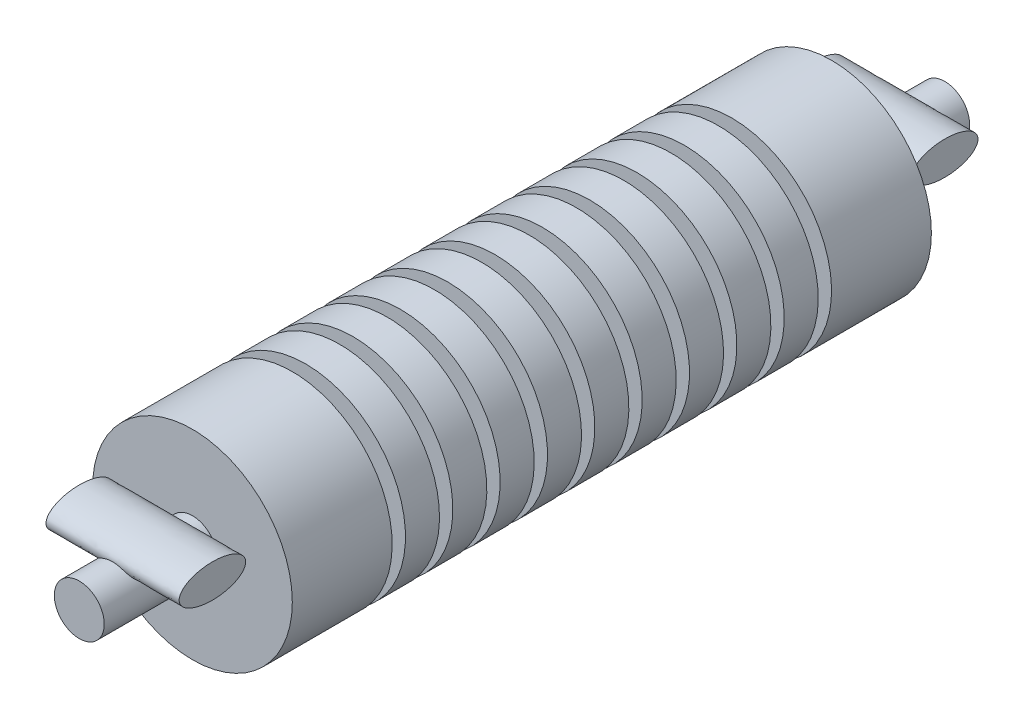
from build123d import *

# Parameters (mm, degrees)
SKETCH1_R               = 1.5
BOSS_EXTRUDE1_DEPTH     = 4.8
CUT_EXTRUDE1_DEPTH      = 6.247856705
CUT_EXTRUDE1_DEPTH_BACK = 6.247856705
SKETCH2_W               = 0.2
SKETCH2_H               = 3
SKETCH3_R               = 0.375
BOSS_EXTRUDE2_DEPTH     = 6.5
SKETCH4_RX              = 0.5
SKETCH4_RY              = 0.25
BOSS_EXTRUDE3_DEPTH     = 1


with BuildPart() as part:
    # Sketch1 → Boss-Extrude1 (new, symmetric)
    with BuildSketch(Plane.XY):
        Circle(SKETCH1_R)
    extrude(amount=BOSS_EXTRUDE1_DEPTH, both=True)

    # Sketch2 → Cut-Extrude1 (cut, two sides: drawn at the far end of the back side and taken through both)
    with BuildSketch(Plane(origin=(0, 0, 0), x_dir=(0, 0, -1), z_dir=(1, 0, 0)).offset(-CUT_EXTRUDE1_DEPTH_BACK)):
        with Locations((-3.2, 0)):
            Rectangle(SKETCH2_W, SKETCH2_H)
        with Locations((-2.488888889, 0)):
            Rectangle(SKETCH2_W, SKETCH2_H)
        with Locations((-1.777777778, 0)):
            Rectangle(SKETCH2_W, SKETCH2_H)
        with Locations((-1.066666667, 0)):
            Rectangle(SKETCH2_W, SKETCH2_H)
        with Locations((-0.355555556, 0)):
            Rectangle(SKETCH2_W, SKETCH2_H)
        with Locations((0.355555556, 0)):
            Rectangle(SKETCH2_W, SKETCH2_H)
        with Locations((1.066666667, 0)):
            Rectangle(SKETCH2_W, SKETCH2_H)
        with Locations((1.777777778, 0)):
            Rectangle(SKETCH2_W, SKETCH2_H)
        with Locations((2.488888889, 0)):
            Rectangle(SKETCH2_W, SKETCH2_H)
        with Locations((3.2, 0)):
            Rectangle(SKETCH2_W, SKETCH2_H)
    extrude(amount=CUT_EXTRUDE1_DEPTH + CUT_EXTRUDE1_DEPTH_BACK, mode=Mode.SUBTRACT)


with BuildPart() as cut_extrude1_piece_1:
    # of the separate pieces the step leaves, piece 1, a body of its own (cut_extrude1_pieces)
    add(part.part.solids().sort_by_distance((1.5, 0, -4.8))[0])



with BuildPart() as cut_extrude1_piece_2:
    # of the separate pieces the step leaves, piece 2, a body of its own (cut_extrude1_pieces)
    add(part.part.solids().sort_by_distance((1.5, 0, 3.3))[0])


with BuildPart() as cut_extrude1_piece_3:
    # of the separate pieces the step leaves, piece 3, a body of its own (cut_extrude1_pieces)
    add(part.part.solids().sort_by_distance((1.5, 0, 2.588888889))[0])


with BuildPart() as cut_extrude1_piece_4:
    # of the separate pieces the step leaves, piece 4, a body of its own (cut_extrude1_pieces)
    add(part.part.solids().sort_by_distance((1.5, 0, -1.677777778))[0])


with BuildPart() as cut_extrude1_piece_5:
    # of the separate pieces the step leaves, piece 5, a body of its own (cut_extrude1_pieces)
    add(part.part.solids().sort_by_distance((1.5, 0, -3.1))[0])


with BuildPart() as cut_extrude1_piece_6:
    # of the separate pieces the step leaves, piece 6, a body of its own (cut_extrude1_pieces)
    add(part.part.solids().sort_by_distance((1.5, 0, -2.388888889))[0])


with BuildPart() as cut_extrude1_piece_7:
    # of the separate pieces the step leaves, piece 7, a body of its own (cut_extrude1_pieces)
    add(part.part.solids().sort_by_distance((1.5, 0, 0.455555556))[0])


with BuildPart() as cut_extrude1_piece_8:
    # of the separate pieces the step leaves, piece 8, a body of its own (cut_extrude1_pieces)
    add(part.part.solids().sort_by_distance((1.5, 0, -0.255555556))[0])


with BuildPart() as cut_extrude1_piece_9:
    # of the separate pieces the step leaves, piece 9, a body of its own (cut_extrude1_pieces)
    add(part.part.solids().sort_by_distance((1.5, 0, 1.877777778))[0])


with BuildPart() as cut_extrude1_piece_10:
    # of the separate pieces the step leaves, piece 10, a body of its own (cut_extrude1_pieces)
    add(part.part.solids().sort_by_distance((1.5, 0, 1.166666667))[0])


with BuildPart() as cut_extrude1_piece_11:
    # of the separate pieces the step leaves, piece 11, a body of its own (cut_extrude1_pieces)
    add(part.part.solids().sort_by_distance((1.5, 0, -0.966666667))[0])


with BuildPart() as cut_extrude1_piece_1_1:
    add(cut_extrude1_piece_1.part)

    add(cut_extrude1_piece_2.part)  # Boss-Extrude2 merges Cut-Extrude1 piece 2

    add(cut_extrude1_piece_3.part)  # Boss-Extrude2 merges Cut-Extrude1 piece 3

    add(cut_extrude1_piece_4.part)  # Boss-Extrude2 merges Cut-Extrude1 piece 4

    add(cut_extrude1_piece_5.part)  # Boss-Extrude2 merges Cut-Extrude1 piece 5

    add(cut_extrude1_piece_6.part)  # Boss-Extrude2 merges Cut-Extrude1 piece 6

    add(cut_extrude1_piece_7.part)  # Boss-Extrude2 merges Cut-Extrude1 piece 7

    add(cut_extrude1_piece_8.part)  # Boss-Extrude2 merges Cut-Extrude1 piece 8

    add(cut_extrude1_piece_9.part)  # Boss-Extrude2 merges Cut-Extrude1 piece 9

    add(cut_extrude1_piece_10.part)  # Boss-Extrude2 merges Cut-Extrude1 piece 10

    add(cut_extrude1_piece_11.part)  # Boss-Extrude2 merges Cut-Extrude1 piece 11
    # Sketch3 → Boss-Extrude2 (add, symmetric)
    with BuildSketch(Plane.XY):
        with Locations(Location((0, 0, 0), (0, 0, 90))):
            Circle(SKETCH3_R)
    extrude(amount=BOSS_EXTRUDE2_DEPTH, both=True)

    # Sketch4 → Boss-Extrude3 (add, symmetric)
    with BuildSketch(Plane(origin=(0, 0, 0), x_dir=(0, 0, -1), z_dir=(1, 0, 0))):
        with Locations((-5.5, 0.375)):
            Ellipse(SKETCH4_RX, SKETCH4_RY)
        with Locations(Location((5.5, 0.375), (0, 0, 180))):
            Ellipse(SKETCH4_RX, SKETCH4_RY)
    extrude(amount=BOSS_EXTRUDE3_DEPTH, both=True)


solid = cut_extrude1_piece_1_1.part
